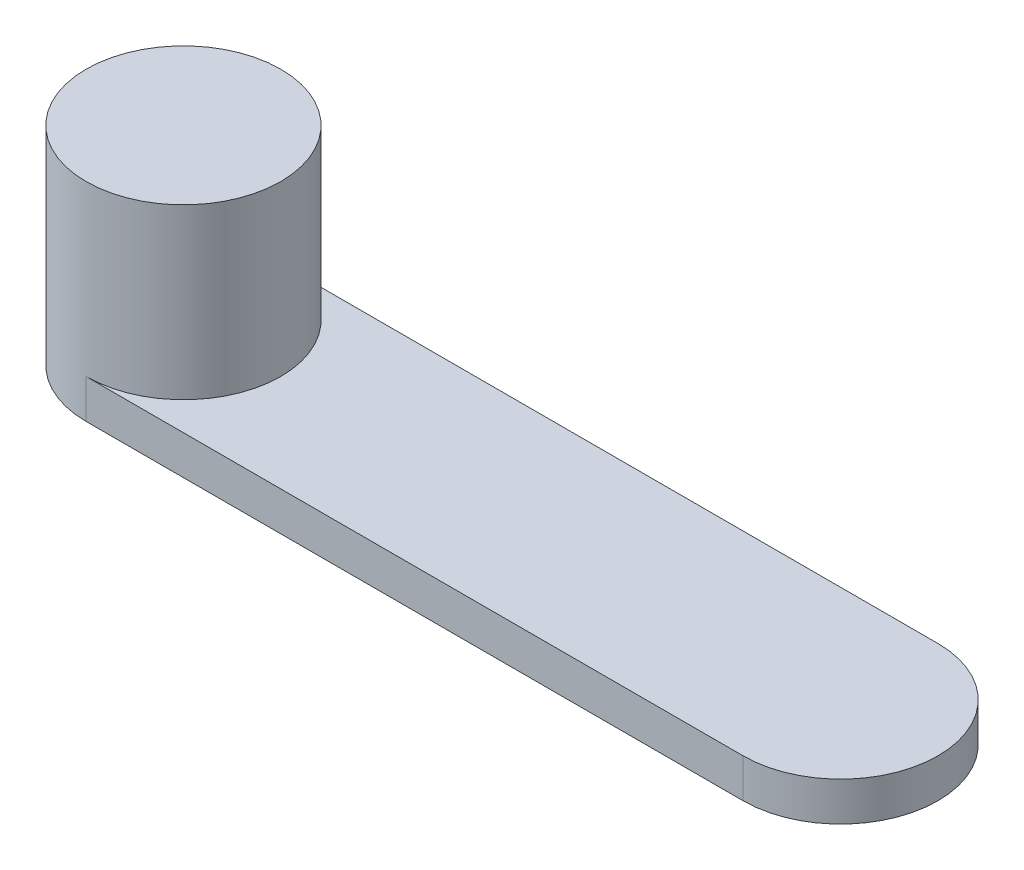
from build123d import *

# Parameters (mm, degrees)
EXTRUDE_1_DEPTH = 8
SKETCH_3_R      = 20
EXTRUDE_2_DEPTH = 34.68


with BuildPart() as part:
    # 草图1 → 凸台-拉伸1 (new body)
    with BuildSketch(Plane(origin=(0, 0, 0), x_dir=(1, 0, 0), z_dir=(0, 1, 0))):
        with BuildLine():
            Line((67.5, -20), (-67.5, -20))
            ThreePointArc((-67.5, -20), (-87.5, 0), (-67.5, 20))
            Line((-67.5, 20), (67.5, 20))
            ThreePointArc((67.5, 20), (87.5, 0), (67.5, -20))
        make_face()
    extrude(amount=EXTRUDE_1_DEPTH)

    # 草图3 → 凸台-拉伸2 (add)
    with BuildSketch(Plane(origin=(0, 8, 0), x_dir=(1, 0, 0), z_dir=(0, 1, 0))):
        with Locations(Location((-67.5, 0, 0), (0, 0, 270))):
            Circle(SKETCH_3_R)
    extrude(amount=EXTRUDE_2_DEPTH)


solid = part.part
